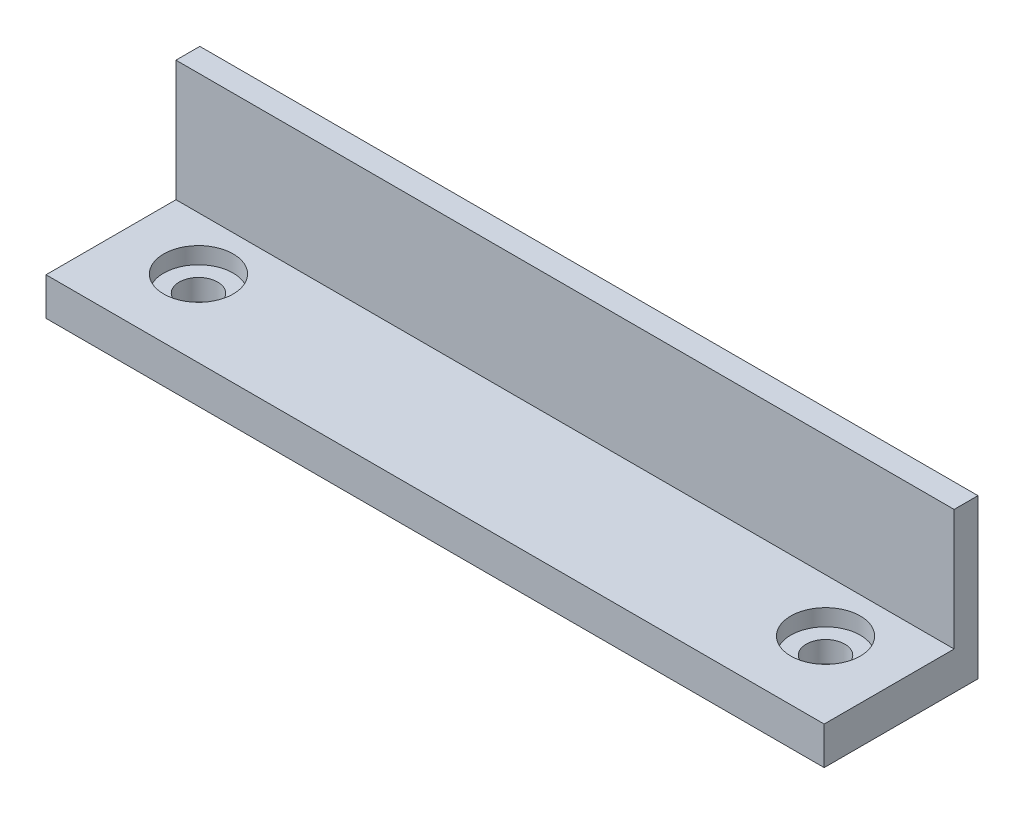
from build123d import *

# Parameters (mm, degrees)
SKETCH1_W           = 103
SKETCH1_H           = 17.2
SKETCH1_R           = 4.6
SKETCH1_H_2         = 3.16
SKETCH1_R_2         = 2.55
BOSS_EXTRUDE1_DEPTH = 5
BOSS_EXTRUDE2_START = 5
SKETCH1_3_W         = 103
SKETCH1_3_H         = 3.16
BOSS_EXTRUDE2_DEPTH = 16
CUT_EXTRUDE1_START  = 2.8
SKETCH1_5_R         = 4.6
SKETCH1_5_R_2       = 2.55
CUT_EXTRUDE1_DEPTH  = 2.2


with BuildPart() as part:
    # Sketch1 → Boss-Extrude1 (new body)
    # profile 1 of 4: a face of its own
    with BuildSketch(Plane(origin=(0, 0, 0), x_dir=(1, 0, 0), z_dir=(0, 1, 0))):
        with Locations((0, -1.58)):
            Rectangle(SKETCH1_W, SKETCH1_H)
        with Locations((-41.5, 0)):
            Circle(SKETCH1_R, mode=Mode.SUBTRACT)
        with Locations((41.5, 0)):
            Circle(SKETCH1_R, mode=Mode.SUBTRACT)
    # profile 2 of 4: a face of its own
    with BuildSketch(Plane(origin=(0, 0, 0), x_dir=(1, 0, 0), z_dir=(0, 1, 0))):
        with Locations((0, 8.6)):
            Rectangle(SKETCH1_W, SKETCH1_H_2)
    # profile 3 of 4: a face of its own
    with BuildSketch(Plane(origin=(0, 0, 0), x_dir=(1, 0, 0), z_dir=(0, 1, 0))):
        with Locations((-41.5, 0)):
            Circle(SKETCH1_R)
        with Locations(Location((-41.5, 0, 0), (0, 0, 270))):
            Circle(SKETCH1_R_2, mode=Mode.SUBTRACT)
    # profile 4 of 4: a face of its own
    with BuildSketch(Plane(origin=(0, 0, 0), x_dir=(1, 0, 0), z_dir=(0, 1, 0))):
        with Locations((41.5, 0)):
            Circle(SKETCH1_R)
        with Locations(Location((41.5, 0, 0), (0, 0, 270))):
            Circle(SKETCH1_R_2, mode=Mode.SUBTRACT)
    extrude(amount=BOSS_EXTRUDE1_DEPTH)

    # Sketch1<3> → Boss-Extrude2 (add)
    with BuildSketch(Plane(origin=(0, 0, 0), x_dir=(1, 0, 0), z_dir=(0, 1, 0)).offset(BOSS_EXTRUDE2_START)):
        with Locations((0, 8.6)):
            Rectangle(SKETCH1_3_W, SKETCH1_3_H)
    extrude(amount=BOSS_EXTRUDE2_DEPTH)

    # Sketch1<5> → Cut-Extrude1 (cut)
    # profile 1 of 2: a face of its own
    with BuildSketch(Plane(origin=(0, 0, 0), x_dir=(1, 0, 0), z_dir=(0, 1, 0)).offset(CUT_EXTRUDE1_START)):
        with Locations(Location((-41.5, 0, 0), (0, 0, 270))):
            Circle(SKETCH1_5_R)
        with Locations(Location((-41.5, 0, 0), (0, 0, 270))):
            Circle(SKETCH1_5_R_2, mode=Mode.SUBTRACT)
    # profile 2 of 2: a face of its own
    with BuildSketch(Plane(origin=(0, 0, 0), x_dir=(1, 0, 0), z_dir=(0, 1, 0)).offset(CUT_EXTRUDE1_START)):
        with Locations(Location((41.5, 0, 0), (0, 0, 270))):
            Circle(SKETCH1_5_R)
        with Locations(Location((41.5, 0, 0), (0, 0, 270))):
            Circle(SKETCH1_5_R_2, mode=Mode.SUBTRACT)
    extrude(amount=CUT_EXTRUDE1_DEPTH, mode=Mode.SUBTRACT)


solid = part.part
